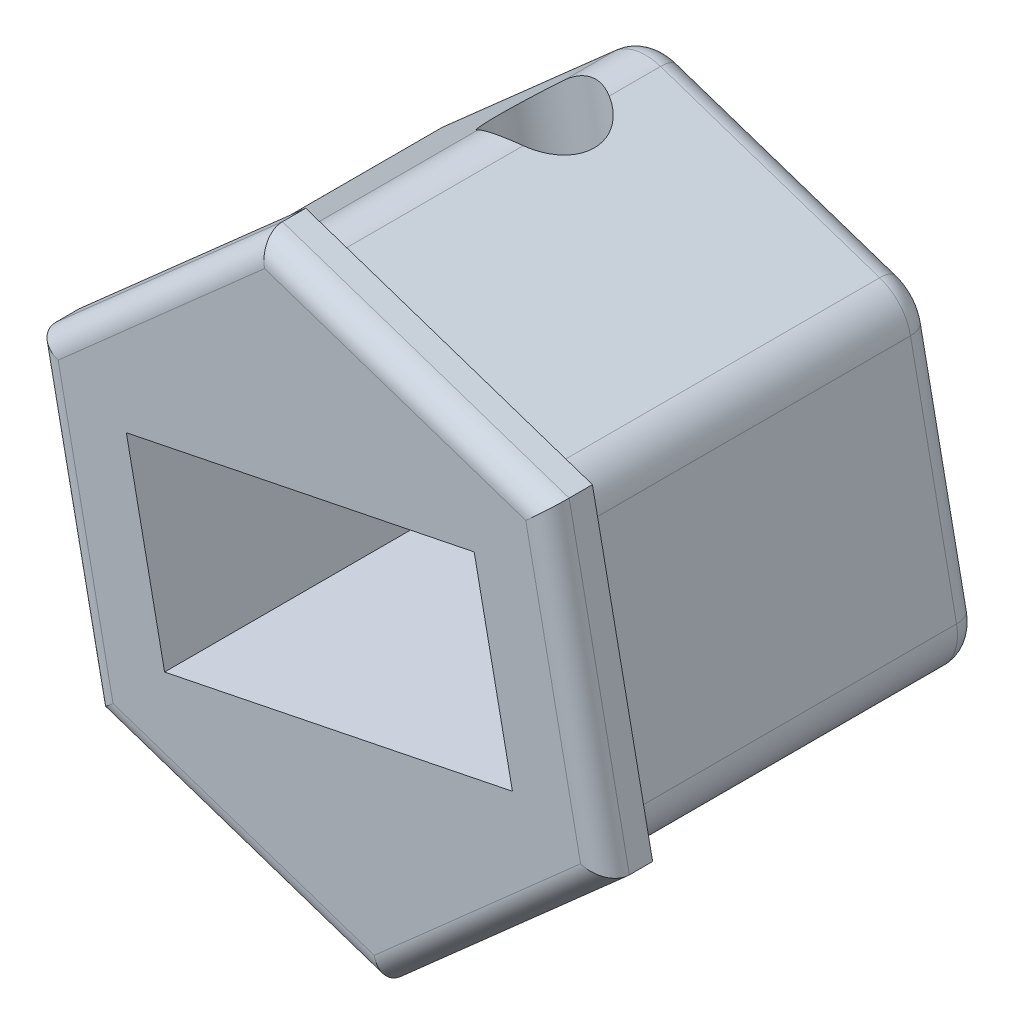
from build123d import *

# Parameters (mm, degrees)
DODANIE_WYCI_GNI_CIE1_DEPTH     = 17
ZAOKR_GLENIE1_R                 = 2
DODANIE_WYCI_GNI_CIE2_DEPTH     = 2
ZAOKR_GLENIE2_R                 = 1
ZAOKR_GLENIE3_R                 = 1
WYTNIJ_WYCI_GNI_CIE1_DEPTH      = 32.35628887
WYTNIJ_WYCI_GNI_CIE1_DEPTH_BACK = 32.35628887
SZKIC4_R                        = 2.1
WYTNIJ_WYCI_GNI_CIE2_DEPTH      = 31.967447566
SZKIC6_R                        = 2.1
SZKIC6_R_2                      = 1.25
DODANIE_WYCI_GNI_CIE3_DEPTH     = 0.51


with BuildPart() as part:
    # Szkic1 → Dodanie-wyciągnięcie1 (new body)
    with BuildSketch(Plane.XY):
        Polygon((1.783068787, -4.564092652), (-0.653727134, 7.430712848), (-12.25993137, 11.317788426), (-21.429339686, 3.210058505), (-18.992543765, -8.784746995), (-7.386339528, -12.671822573), align=None)
    extrude(amount=DODANIE_WYCI_GNI_CIE1_DEPTH)

    # Zaokrąglenie1
    zaokr_glenie1_edges = [part.edges().sort_by_distance(p)[0] for p in [
        (-7.386339528, -12.671822573, 8.5),
        (-18.992543765, -8.784746995, 8.5),
        (-21.429339686, 3.210058505, 8.5),
        (-12.25993137, 11.317788426, 8.5),
        (-0.653727134, 7.430712848, 8.5),
        (1.783068787, -4.564092652, 8.5),
    ]]
    fillet(zaokr_glenie1_edges, radius=ZAOKR_GLENIE1_R)

    # Szkic3 → Dodanie-wyciągnięcie2 (add)
    with BuildSketch(Plane.XY.offset(17)):
        Polygon((-0.091452095, 7.927884965), (-12.409357535, 12.053318952), (-22.141040889, 3.448416913), (-19.554818803, -9.281919113), (-7.236913363, -13.407353099), (2.494769991, -4.80245106), align=None)
    extrude(amount=-DODANIE_WYCI_GNI_CIE2_DEPTH)

    # Zaokrąglenie2
    zaokr_glenie2_edges = [part.edges().sort_by_distance(p)[0] for p in [
        (-6.456829252, 9.374250637, 0),
        (-2.80163537, -8.617957613, 0),
        (-13.189441647, -10.728284784, 0),
        (-20.210941725, -2.787344245, 0),
        (-16.844635528, 7.263923465, 0),
        (0.564670827, 1.433310098, 0),
        (-12.198333493, 11.014581025, 0),
        (-21.135955436, 3.111800131, 0),
        (-18.760757392, -8.579797968, 0),
        (-7.447937406, -12.368615173, 0),
        (1.489684537, -4.465834278, 0),
        (-0.885513507, 7.225763821, 0),
    ]]
    fillet(zaokr_glenie2_edges, radius=ZAOKR_GLENIE2_R)

    # Zaokrąglenie3
    zaokr_glenie3_edges = [part.edges().sort_by_distance(p)[0] for p in [
        (1.201658948, 1.562716953, 17),
        (-6.250404815, 9.990601959, 17),
        (-17.275199212, 7.750867932, 17),
        (-20.847929846, -2.9167511, 17),
        (-13.395866083, -11.344636106, 17),
        (-2.371071686, -9.10490208, 17),
    ]]
    fillet(zaokr_glenie3_edges, radius=ZAOKR_GLENIE3_R)

    # Szkic4 → Wytnij-wyciągnięcie1 (cut, two sides: drawn at the far end of the back side and taken through both)
    with BuildSketch(Plane(origin=(-0.257260592, 1.266331223, 0), x_dir=(0.9799817241599056, 0.19908746899937949, 0), z_dir=(-0.19908746899937946, 0.9799817241599055, 0)).offset(-WYTNIJ_WYCI_GNI_CIE1_DEPTH_BACK)):
        with Locations(Location((-9.76127883, -5.05, 0), (0, 0, 241.563109851))):
            Circle(SZKIC4_R)
    extrude(amount=WYTNIJ_WYCI_GNI_CIE1_DEPTH + WYTNIJ_WYCI_GNI_CIE1_DEPTH_BACK, mode=Mode.SUBTRACT)

    # Szkic5 → Wytnij-wyciągnięcie2 (cut, through all)
    with BuildSketch(Plane.XY.offset(17)):
        Polygon((-18.116731906, 1.847365587), (-3.172010612, 4.88344949), (-1.529538993, -3.201399735), (-16.474260286, -6.237483637), align=None)
    extrude(amount=-WYTNIJ_WYCI_GNI_CIE2_DEPTH, mode=Mode.SUBTRACT)

    # Szkic6 → Dodanie-wyciągnięcie3 (add)
    with BuildSketch(Plane(origin=(-1.078496401, 5.308755835, 0), x_dir=(0.9799817241599059, 0.19908746899937776, 0), z_dir=(0.19908746899937776, -0.9799817241599059, 0))):
        with Locations(Location((-9.76127883, 5.05, 0), (0, 0, 241.563109851))):
            Circle(SZKIC6_R)
        with Locations((-9.76127883, 5.05)):
            Circle(SZKIC6_R_2, mode=Mode.SUBTRACT)
    dodanie_wyci_gni_cie3 = extrude(amount=-DODANIE_WYCI_GNI_CIE3_DEPTH)

    # Lustro1: Dodanie-wyciągnięcie3 across plane
    add(dodanie_wyci_gni_cie3.mirror(Plane(origin=(-0.257260592, 1.266331223, 0), x_dir=(0, 0, 1), z_dir=(-0.19908746899937949, 0.9799817241599056, 0))))


solid = part.part
